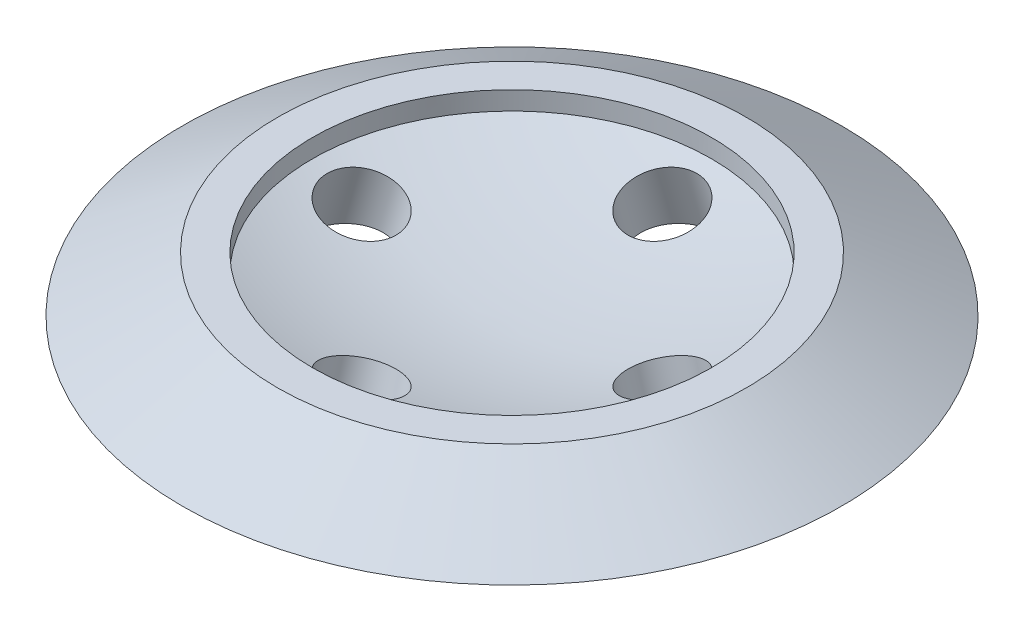
from build123d import *

# Parameters (mm, degrees)
PATTERN_CIRCULAR_1_COUNT = 4


with BuildPart() as part:
    # 草图1 → 旋转1 (revolve)
    with BuildSketch(Plane(origin=(0, 0, 0), x_dir=(0, 0, -1), z_dir=(1, 0, 0)), mode=Mode.PRIVATE) as revolve_1_sk:
        with BuildLine():
            Line((60, 0), (42.679491924, 10))
            Line((42.679491924, 10), (36.32612495, 10))
            Line((36.32612495, 10), (36.32612495, 6.632164181))
            ThreePointArc((36.32612495, 6.632164181), (18.463294368, 1.671632263), (0, 0))
            Line((0, 0), (0, -5.085825136))
            Line((0, -5.085825136), (45.191092466, -5.085825136))
            Line((45.191092466, -5.085825136), (54, 0))
            Line((54, 0), (60, 0))
        make_face()
    revolve(revolve_1_sk.sketch.rotate(Axis((0, 23.869545483, 0), (0, -1, 0)), 180), axis=Axis((0, 23.869545483, 0), (0, -1, 0)))

    # 草图2 → 切除-旋转1 (revolve, cut)
    with BuildSketch(Plane.XY, mode=Mode.PRIVATE) as cut_revolve_1_sk:
        Polygon((23.11658969, 18.792484499), (29.364790714, 20.584127312), (39.564082896, -14.98503156), (33.315881872, -16.776674373), align=None)
    cut_revolve_1 = revolve(cut_revolve_1_sk.sketch.rotate(Axis((0, 99.409613277, 0), (0.2756373558169999, -0.9612616959383187, 0)), 180), axis=Axis((0, 99.409613277, 0), (0.2756373558169999, -0.9612616959383187, 0)), mode=Mode.SUBTRACT)

    # 阵列(圆周)1: 切除-旋转1 ×4 about axis
    pattern_circular_1_axis = Axis((0, 6.632164181, 0), (0, 1, 0))
    for i in range(1, PATTERN_CIRCULAR_1_COUNT):
        add(cut_revolve_1.rotate(pattern_circular_1_axis, i * 360 / PATTERN_CIRCULAR_1_COUNT), mode=Mode.SUBTRACT)


solid = part.part
